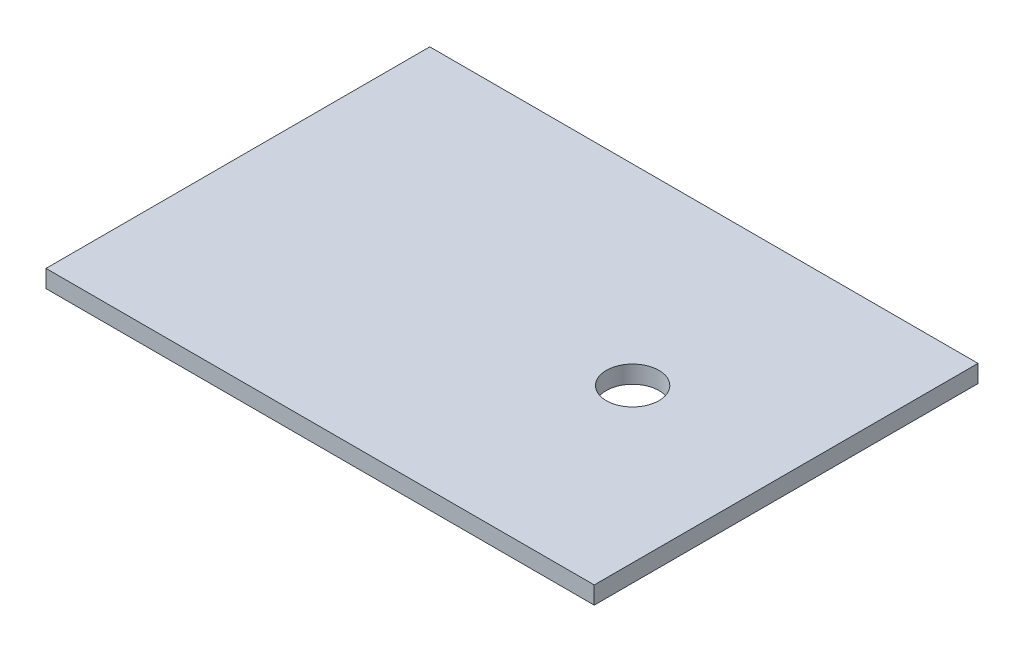
from build123d import *

# Parameters (mm, degrees)
SKETCH1_W           = 250
SKETCH1_H           = 175
SKETCH1_R           = 12
BOSS_EXTRUDE1_DEPTH = 8


with BuildPart() as part:
    # Sketch1 → Boss-Extrude1 (new body)
    with BuildSketch(Plane(origin=(0, 0, 0), x_dir=(1, 0, 0), z_dir=(0, 1, 0))):
        Rectangle(SKETCH1_W, SKETCH1_H)
        with Locations(Location((55, 0, 0), (0, 0, 270))):
            Circle(SKETCH1_R, mode=Mode.SUBTRACT)
    extrude(amount=BOSS_EXTRUDE1_DEPTH)


solid = part.part
